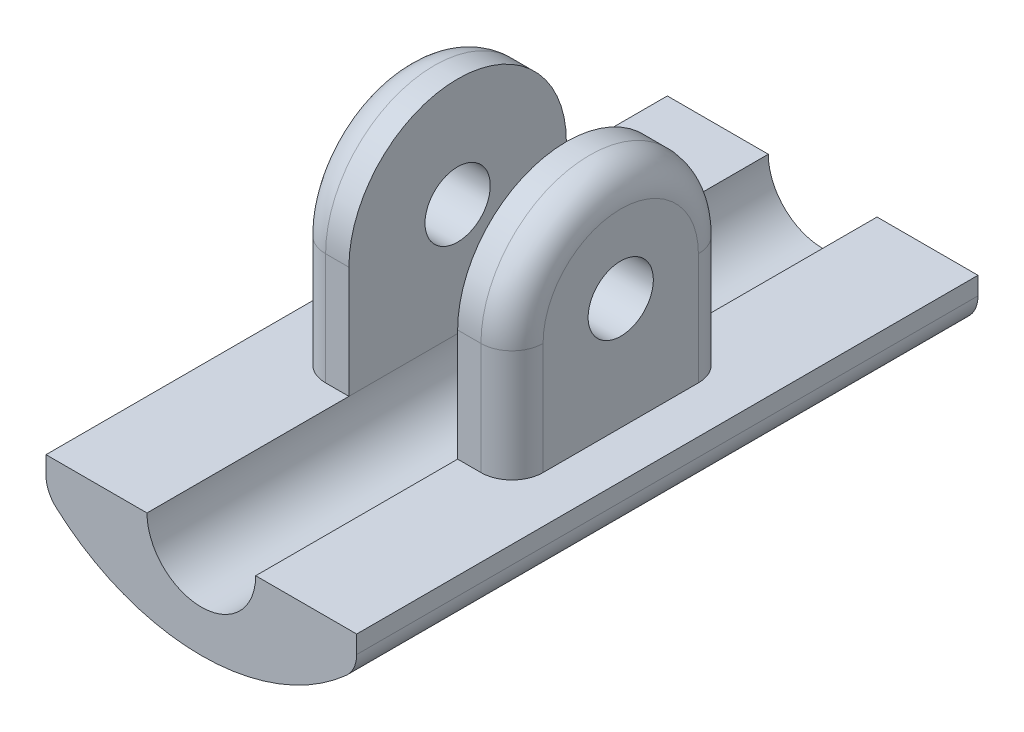
from build123d import *

# Parameters (mm, degrees)
BOSS_EXTRUDE1_DEPTH      = 20
BOSS_EXTRUDE1_DEPTH_BACK = 20
BOSS_EXTRUDE2_DEPTH      = 7
BOSS_EXTRUDE2_DEPTH_BACK = 7
SKETCH2_R                = 2.1
SKETCH3_W                = 7
SKETCH3_H                = 15
CUT_EXTRUDE1_DEPTH       = 60
FILLET1_R                = 2
SKETCH4_R                = 3.5
CUT_EXTRUDE2_DEPTH       = 60
FILLET3_R                = 2


with BuildPart() as part:
    # Sketch1 → Boss-Extrude1 (new, two sides: drawn at the far end of the back side and taken through both)
    with BuildSketch(Plane.XY.offset(-BOSS_EXTRUDE1_DEPTH_BACK)):
        with BuildLine():
            Line((-10, 2), (-10, 0))
            ThreePointArc((-10, 0), (0, -4.202041029), (10, 0))
            Line((10, 0), (10, 2))
            Line((10, 2), (-10, 2))
        make_face()
    extrude(amount=BOSS_EXTRUDE1_DEPTH + BOSS_EXTRUDE1_DEPTH_BACK)

    # Sketch2 → Boss-Extrude2 (add, two sides: drawn at the far end of the back side and taken through both)
    with BuildSketch(Plane(origin=(0, 0, 0), x_dir=(0, 0, -1), z_dir=(1, 0, 0)).offset(-BOSS_EXTRUDE2_DEPTH_BACK)):
        with BuildLine():
            Line((-7, 9.2), (-7, 2))
            Line((-7, 2), (7, 2))
            Line((7, 2), (7, 9.2))
            ThreePointArc((7, 9.2), (0, 16.2), (-7, 9.2))
        make_face()
        with Locations((0, 9.2)):
            Circle(SKETCH2_R, mode=Mode.SUBTRACT)
    extrude(amount=BOSS_EXTRUDE2_DEPTH + BOSS_EXTRUDE2_DEPTH_BACK)

    # Sketch3 → Cut-Extrude1 (cut)
    with BuildSketch(Plane.XY.offset(7)):
        with Locations((0, 9.5)):
            Rectangle(SKETCH3_W, SKETCH3_H)
    extrude(amount=-CUT_EXTRUDE1_DEPTH, mode=Mode.SUBTRACT)

    # Fillet1
    fillet1_edges = [part.edges().sort_by_distance(p)[0] for p in [
        (-10, 0, 0),
        (10, 0, 0),
    ]]
    fillet(fillet1_edges, radius=FILLET1_R)

    # Sketch4 → Cut-Extrude2 (cut)
    with BuildSketch(Plane.XY.offset(20)):
        with Locations((0, 2)):
            Circle(SKETCH4_R)
    extrude(amount=-CUT_EXTRUDE2_DEPTH, mode=Mode.SUBTRACT)

    # Fillet3
    fillet3_edges = [part.edges().sort_by_distance(p)[0] for p in [
        (-7, 5.6, -7),
        (-7, 5.6, 7),
        (7, 5.6, -7),
        (7, 5.6, 7),
        (-7, 16.2, 0),
        (7, 16.2, 0),
    ]]
    fillet(fillet3_edges, radius=FILLET3_R)


solid = part.part
